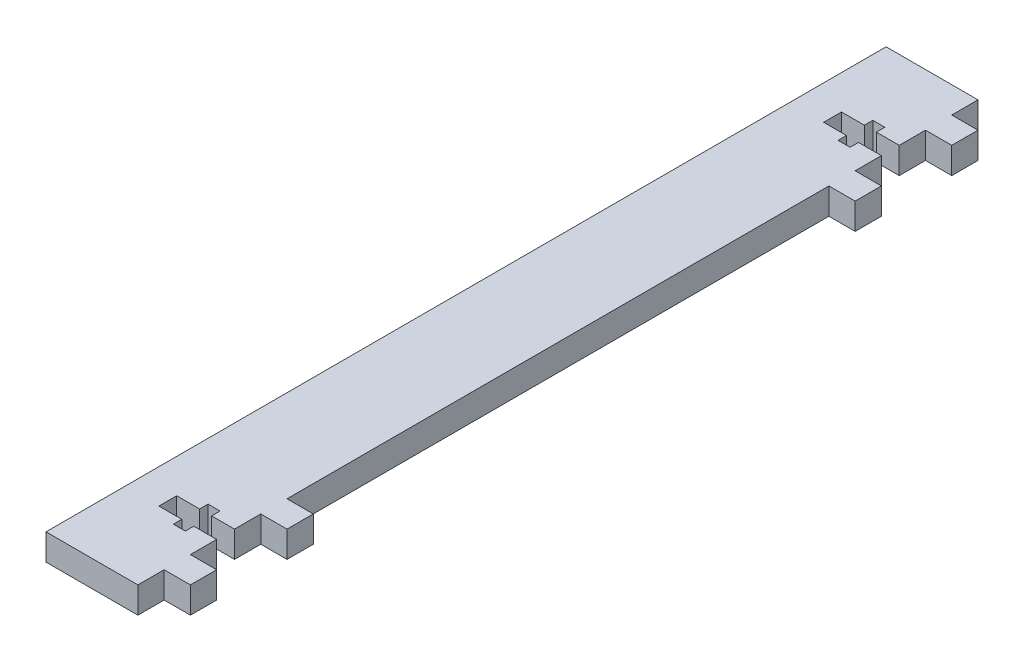
from build123d import *

# Parameters (mm, degrees)
BOSS_EXTRUDE1_DEPTH = 6.35


with BuildPart() as part:
    # Sketch1 → Boss-Extrude1 (new body)
    with BuildSketch(Plane(origin=(0, 0, 0), x_dir=(1, 0, 0), z_dir=(0, 1, 0))):
        Polygon((11.1125, 95.25), (11.1125, 101.6), (-11.1125, 101.6), (-11.1125, -101.6), (11.1125, -101.6), (11.1125, -95.25), (17.4625, -95.25), (17.4625, -88.9), (11.1125, -88.9), (11.1125, -82.55), (5.577500021, -82.55), (5.577500021, -84.590999982), (2.677499979, -84.590999982), (2.677499979, -82.55), (-2.8575, -82.55), (-2.8575, -78.232), (2.677499979, -78.232), (2.677499979, -76.191000018), (5.577500021, -76.191000018), (5.577500021, -78.232), (11.1125, -78.232), (11.1125, -71.882), (17.4625, -71.882), (17.4625, -65.532), (11.1125, -65.532), (11.1125, 65.532), (17.4625, 65.532), (17.4625, 71.882), (11.1125, 71.882), (11.1125, 78.232), (5.577500021, 78.232), (5.577500021, 76.191000018), (2.677499979, 76.191000018), (2.677499979, 78.232), (-2.8575, 78.232), (-2.8575, 82.55), (2.677499979, 82.55), (2.677499979, 84.590999982), (5.577500021, 84.590999982), (5.577500021, 82.55), (11.1125, 82.55), (11.1125, 88.9), (17.4625, 88.9), (17.4625, 95.25), align=None)
    extrude(amount=BOSS_EXTRUDE1_DEPTH)


solid = part.part
